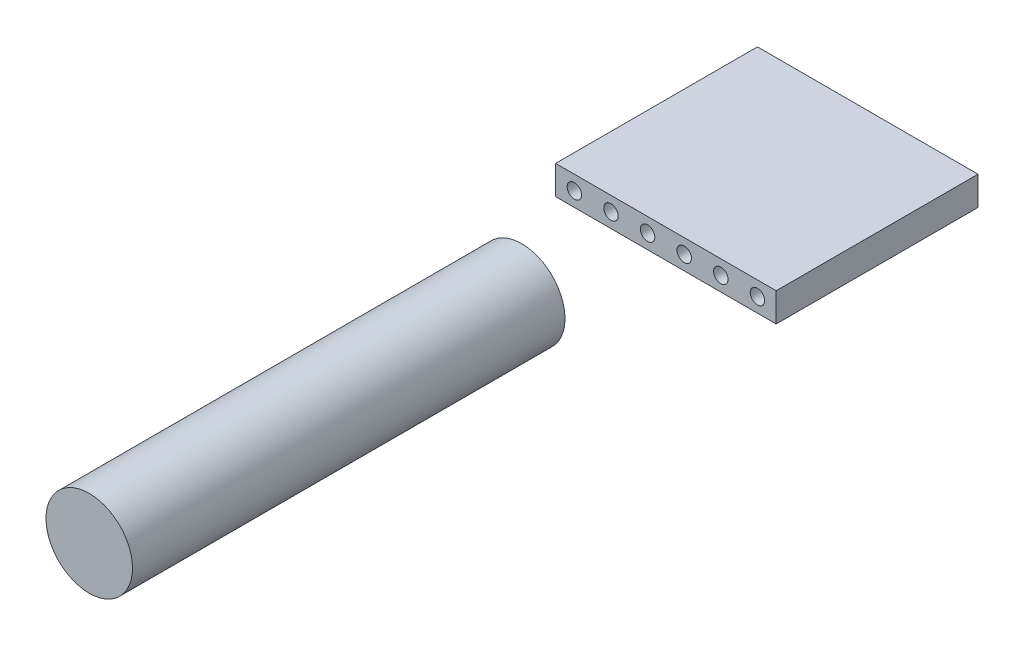
from build123d import *

# Parameters (mm, degrees)
ESQUISSE1_W             = 15.3
ESQUISSE1_H             = 2
ESQUISSE1_R             = 0.5
BOSS_EXTRU_1_DEPTH      = 14
ESQUISSE2_R             = 3
BOSS_EXTRU_2_DEPTH      = 40
ESQUISSE3_R             = 4
ENL_V_MAT_EXTRU_1_DEPTH = 10


with BuildPart() as part:
    # Esquisse1 → Boss.-Extru.1 (new body)
    with BuildSketch(Plane.XY):
        with Locations((7.65, 0)):
            Rectangle(ESQUISSE1_W, ESQUISSE1_H)
        with Locations((1.3, 0)):
            Circle(ESQUISSE1_R, mode=Mode.SUBTRACT)
        with Locations((3.84, 0)):
            Circle(ESQUISSE1_R, mode=Mode.SUBTRACT)
        with Locations((6.38, 0)):
            Circle(ESQUISSE1_R, mode=Mode.SUBTRACT)
        with Locations((8.92, 0)):
            Circle(ESQUISSE1_R, mode=Mode.SUBTRACT)
        with Locations((11.46, 0)):
            Circle(ESQUISSE1_R, mode=Mode.SUBTRACT)
        with Locations((14, 0)):
            Circle(ESQUISSE1_R, mode=Mode.SUBTRACT)
    extrude(amount=BOSS_EXTRU_1_DEPTH)

    # Esquisse2 → Boss.-Extru.2 (add)
    with BuildSketch(Plane.XY.offset(14)):
        with Locations(Location((7.65, 2, 0), (0, 0, 199.471220634))):
            Circle(ESQUISSE2_R)
    extrude(amount=BOSS_EXTRU_2_DEPTH)

    # Esquisse3 → Enlèv. mat.-Extru.1 (cut)
    with BuildSketch(Plane(origin=(0, 0, 14), x_dir=(-1, 0, 0), z_dir=(0, 0, -1))):
        with Locations((-7.65, 2)):
            Circle(ESQUISSE3_R)
    extrude(amount=-ENL_V_MAT_EXTRU_1_DEPTH, mode=Mode.SUBTRACT)


with BuildPart() as enl_v_mat_extru_1_piece_1:
    # of the separate pieces the step leaves, piece 1, a body of its own (enl_v_mat_extru_1_pieces)
    add(part.part.solids().sort_by_distance((4.821572875, 1, 24))[0])


with BuildPart() as enl_v_mat_extru_1_piece_2:
    # of the separate pieces the step leaves, piece 2, a body of its own (enl_v_mat_extru_1_pieces)
    add(part.part.solids().sort_by_distance((0, 1, 0))[0])


solid = Compound([enl_v_mat_extru_1_piece_1.part, enl_v_mat_extru_1_piece_2.part])
